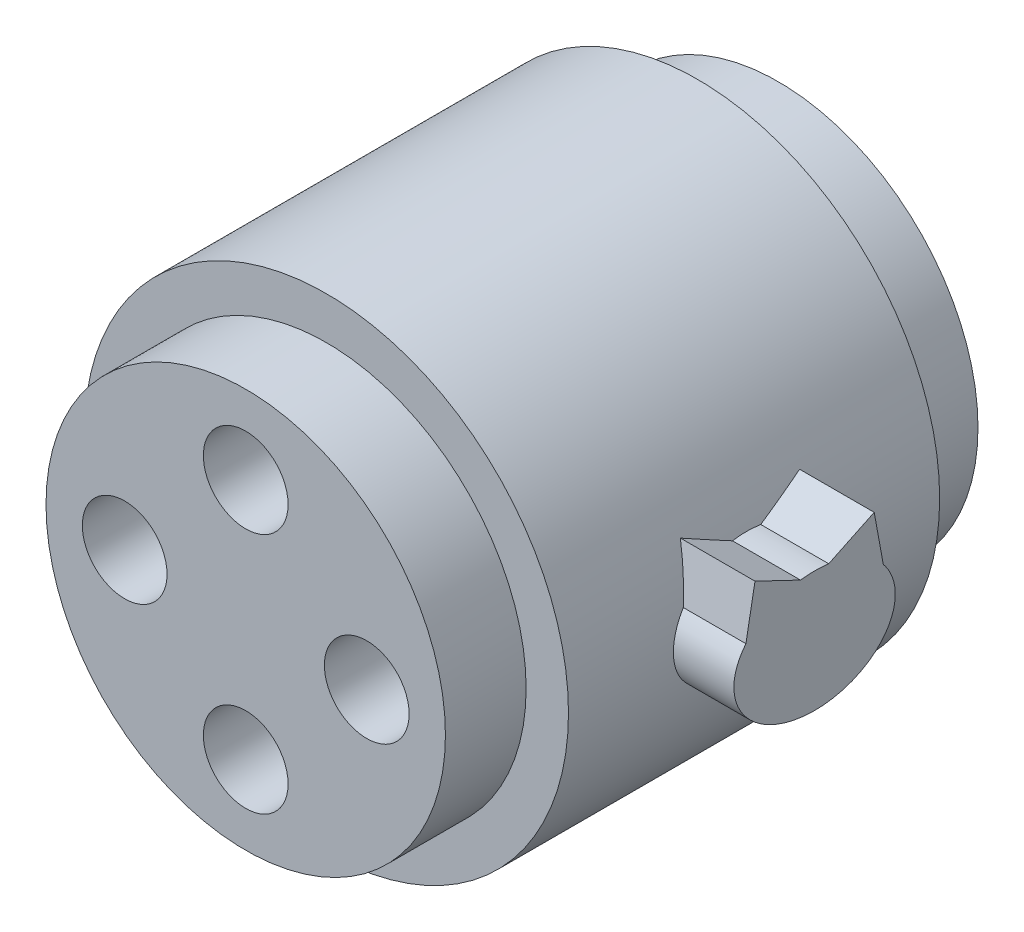
from build123d import *

# Parameters (mm, degrees)
SKETCH_1_R          = 12
EXTRUDE_1_DEPTH     = 18.4
SKETCH_2_R          = 9.9
EXTRUDE_2_DEPTH     = 4
EXTRUDE_START       = 4
SKETCH_3_R          = 9.9
EXTRUDE_3_DEPTH     = 4
EXTRUDE_4_DEPTH     = 15
SKETCH_4_R          = 2.1
CUT_EXTRUDE_1_DEPTH = 33.649042948


with BuildPart() as part:
    # 草图1 → 凸台-拉伸1 (new body)
    with BuildSketch(Plane.XY):
        Circle(SKETCH_1_R)
    extrude(amount=EXTRUDE_1_DEPTH)

    # 草图2 → 凸台-拉伸2 (add)
    with BuildSketch(Plane.XY.offset(18.4)):
        Circle(SKETCH_2_R)
    extrude(amount=EXTRUDE_2_DEPTH)

    # 草图3 → 凸台-拉伸3 (add)
    with BuildSketch(Plane(origin=(0, 0, 0), x_dir=(-1, 0, 0), z_dir=(0, 0, -1)).offset(EXTRUDE_START)):
        with Locations(Location((0, 0, 0), (0, 0, 180))):
            Circle(SKETCH_3_R)
    extrude(amount=-EXTRUDE_3_DEPTH)

    # 草图7 → 凸台-拉伸4 (add)
    with BuildSketch(Plane(origin=(0, 0, 0), x_dir=(0, 0, -1), z_dir=(1, 0, 0))):
        with BuildLine():
            Line((-12.154769624, 4.033526555), (-12.60491347, 1.574386356))
            add(Edge.make_bspline(
                [(-12.60491347, 1.574386356), (-16.365153372, -3), (-9.2, -3), (-2.034846628, -3), (-5.79508653, 1.574386356)],
                knots=[2.589117856, 2.589117856, 2.589117856, 4.71238898, 4.71238898, 6.835660105, 6.835660105, 6.835660105], degree=2, weights=[1, 0.487444637, 1, 0.487444637, 1]))
            Line((-5.79508653, 1.574386356), (-6.245230376, 4.033526555))
            Line((-6.245230376, 4.033526555), (-8.5, 2.9537053))
            add(Edge.make_bspline(
                [(-8.5, 2.9537053), (-9.2, 3.047020297), (-9.9, 2.9537053)],
                knots=[1.394890559, 1.394890559, 1.394890559, 1.746702095, 1.746702095, 1.746702095], degree=2, weights=[1, 0.984568433, 1]))
            Line((-9.9, 2.9537053), (-12.154769624, 4.033526555))
        make_face()
    extrude(amount=EXTRUDE_4_DEPTH)

    # 草图4 → 切除-拉伸1 (cut, through all)
    with BuildSketch(Plane.XY.offset(22.4)):
        with Locations((0, 6)):
            Circle(SKETCH_4_R)
        with Locations((6, 0)):
            Circle(SKETCH_4_R)
        with Locations((0, -6)):
            Circle(SKETCH_4_R)
        with Locations((-6, 0)):
            Circle(SKETCH_4_R)
    extrude(amount=-CUT_EXTRUDE_1_DEPTH, mode=Mode.SUBTRACT)


solid = part.part
